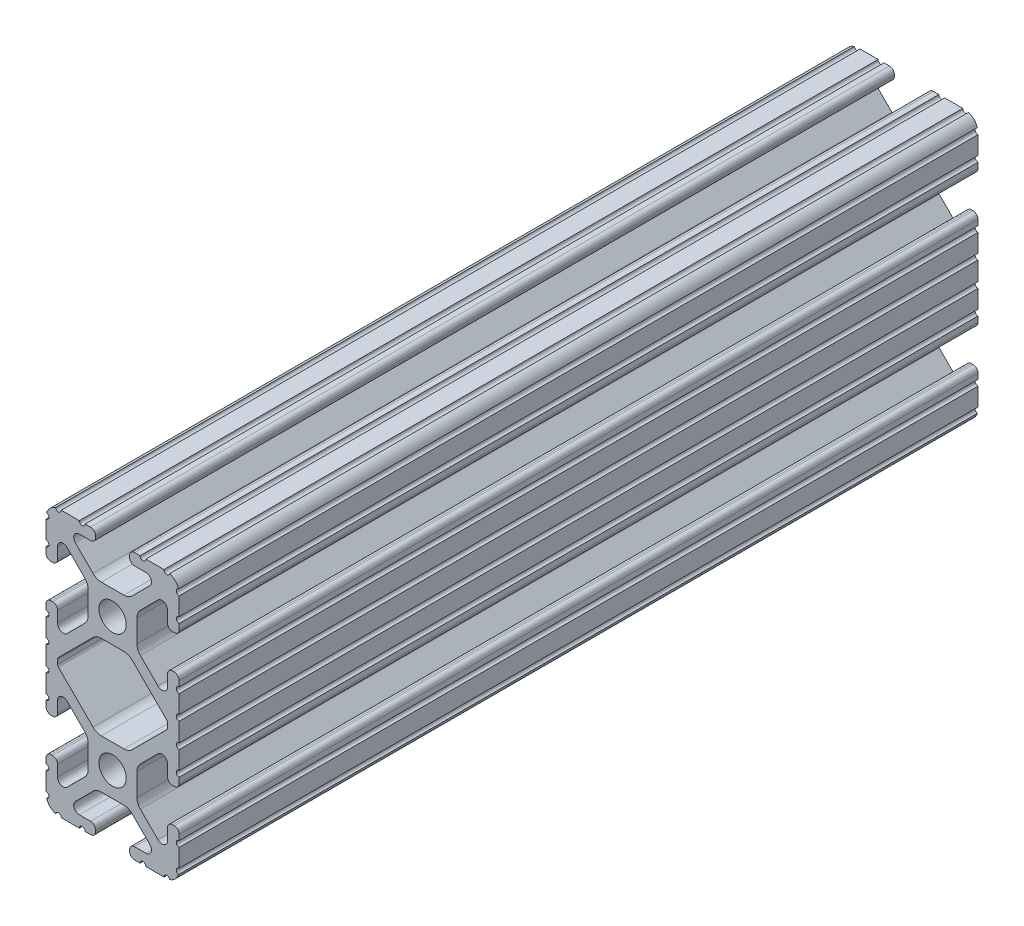
from build123d import *

# Parameters (mm, degrees)
BOSS_EXTRUDE1_DEPTH     = 76.2
CUT_EXTRUDE1_DEPTH      = 82.319677815
CUT_EXTRUDE1_DEPTH_BACK = 82.319677815
SKETCH5_R               = 0.55245
BOSS_EXTRUDE2_DEPTH     = 76.2
CUT_EXTRUDE2_DEPTH      = 82.319677815
CUT_EXTRUDE2_DEPTH_BACK = 82.319677815


with BuildPart() as part:
    # Sketch4 → Boss-Extrude1 (new, symmetric)
    with BuildSketch(Plane.XY):
        with BuildLine():
            Line((4.190365, -25.4), (10.11729625, -25.4))
            ThreePointArc((10.11729625, -25.4), (11.943543585, -24.643543585), (12.7, -22.81729625))
            Line((12.7, -22.81729625), (12.7, -16.890365))
            ThreePointArc((12.7, -16.890365), (12.42492494, -16.22627506), (11.760835, -15.9512))
            Line((11.760835, -15.9512), (11.429365, -15.9512))
            ThreePointArc((11.429365, -15.9512), (10.76527506, -16.22627506), (10.4902, -16.890365))
            Line((10.4902, -16.890365), (10.4902, -19.048478019))
            ThreePointArc((10.4902, -19.048478019), (9.830707141, -20.035478831), (8.666460301, -19.803895736))
            Line((8.666460301, -19.803895736), (5.299899128, -16.437334563))
            ThreePointArc((5.299899128, -16.437334563), (4.817571085, -15.715479634), (4.6482, -14.86399369))
            Line((4.6482, -14.86399369), (4.6482, -12.7))
            Line((4.6482, -12.7), (2.6035, -12.7))
            ThreePointArc((2.6035, -12.7), (1.840952505, -14.540952505), (0, -15.3035))
            Line((0, -15.3035), (0, -17.3482))
            Line((0, -17.3482), (2.16399369, -17.3482))
            ThreePointArc((2.16399369, -17.3482), (3.015479634, -17.517571085), (3.737334563, -17.999899128))
            Line((3.737334563, -17.999899128), (7.103895736, -21.366460301))
            ThreePointArc((7.103895736, -21.366460301), (7.335478831, -22.530707141), (6.348478019, -23.1902))
            Line((6.348478019, -23.1902), (4.190365, -23.1902))
            ThreePointArc((4.190365, -23.1902), (3.52627506, -23.46527506), (3.2512, -24.129365))
            Line((3.2512, -24.129365), (3.2512, -24.460835))
            ThreePointArc((3.2512, -24.460835), (3.52627506, -25.12492494), (4.190365, -25.4))
        make_face()
    extrude(amount=BOSS_EXTRUDE1_DEPTH, both=True)

    # Sketch5 → Cut-Extrude1 (cut, two sides: drawn at the far end of the back side and taken through both)
    with BuildSketch(Plane.XY.offset(-CUT_EXTRUDE1_DEPTH_BACK)):
        with Locations((10.356153152, -25.4)):
            Circle(SKETCH5_R)
        with Locations((5.796028019, -25.4)):
            Circle(SKETCH5_R)
        with Locations((12.7, -23.056153152)):
            Circle(SKETCH5_R)
        with Locations((12.7, -18.496028019)):
            Circle(SKETCH5_R)
    extrude(amount=CUT_EXTRUDE1_DEPTH + CUT_EXTRUDE1_DEPTH_BACK, mode=Mode.SUBTRACT)

    # Mirror1: part across plane


with BuildPart() as part_1:
    add(part.part)
    add(part.part.mirror(Plane(origin=(4.6482, -12.7, 76.2), x_dir=(0, 0, 1), z_dir=(0, -1, 0))))

    # Sketch6 → Boss-Extrude2 (add, symmetric)
    with BuildSketch(Plane.XY):
        with BuildLine():
            Line((12.7, -1.791396848), (12.7, 0))
            Line((12.7, 0), (9.803703152, 0))
            Line((9.803703152, 0), (9.803703152, -2.343846848))
            Line((9.803703152, -2.343846848), (12.14755, -2.343846848))
            ThreePointArc((12.14755, -2.343846848), (12.309358859, -1.953205706), (12.7, -1.791396848))
        make_face()
    extrude(amount=BOSS_EXTRUDE2_DEPTH, both=True)

    # Sketch7 → Cut-Extrude2 (cut, two sides: drawn at the far end of the back side and taken through both)
    with BuildSketch(Plane.XY.offset(-CUT_EXTRUDE2_DEPTH_BACK)):
        with BuildLine():
            Line((5.420615149, -5.716820286), (10.328391141, -0.809044294))
            ThreePointArc((10.328391141, -0.809044294), (10.448147248, -0.629816615), (10.4902, -0.418403152))
            Line((10.4902, -0.418403152), (10.4902, 0))
            Line((10.4902, 0), (0, 0))
            Line((0, 0), (5.420615149, -5.716820286))
        make_face()
    extrude(amount=CUT_EXTRUDE2_DEPTH + CUT_EXTRUDE2_DEPTH_BACK, mode=Mode.SUBTRACT)

    # Mirror2: part across plane


with BuildPart() as part_2:
    add(part_1.part)
    add(part_1.part.mirror(Plane.ZX))

    # Mirror3: part across plane


with BuildPart() as part_3:
    add(part_2.part)
    add(part_2.part.mirror(Plane(origin=(0, 0, 0), x_dir=(0, 0, 1), z_dir=(1, 0, 0))))


solid = part_3.part
